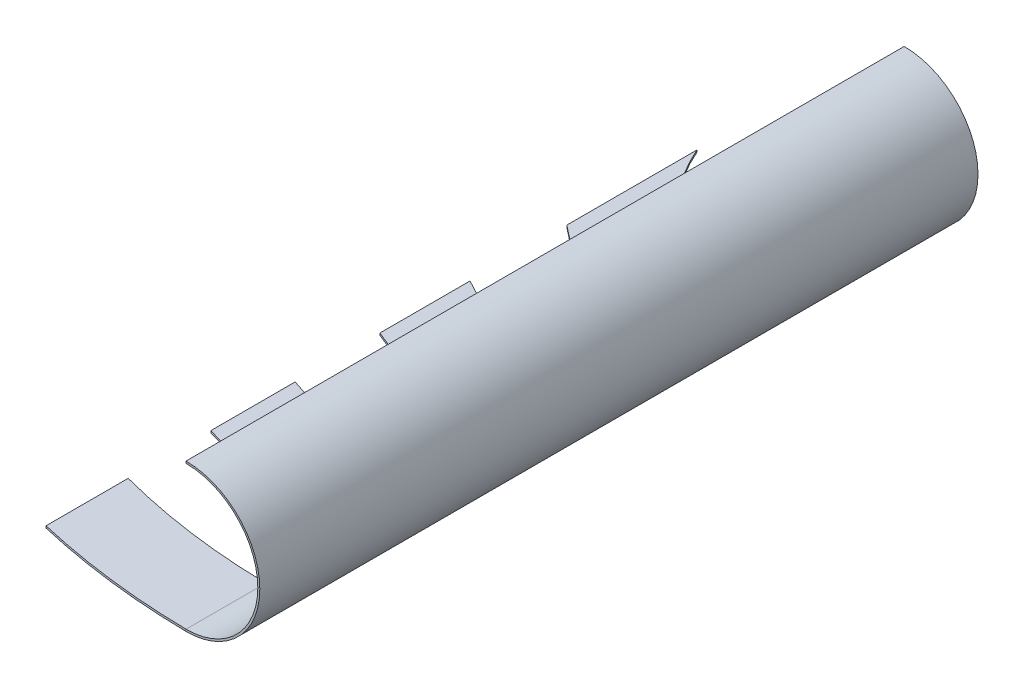
from build123d import *

# Parameters (mm, degrees)
SKETCH_1_R           = 18.5
SKETCH_1_R_2         = 18
EXTRUDE_1_DEPTH      = 180
SKETCH_15_W          = 19.647344242
SKETCH_15_H          = 48.423013506
CUT_EXTRUDE_7_DEPTH  = 208.5
SKETCH_16_W          = 20
SKETCH_16_H          = 0.5
EXTRUDE_4_DEPTH      = 40
SKETCH_17_W          = 20
SKETCH_17_H          = 1
CUT_EXTRUDE_8_DEPTH  = 40
EXTRUDE_8_DEPTH      = 0.5
CUT_EXTRUDE_10_DEPTH = 0.5


with BuildPart() as part:
    # 草图1 → 凸台-拉伸1 (new body)
    with BuildSketch(Plane.XY):
        with Locations(Location((0, 0, 0), (0, 0, 180))):
            Circle(SKETCH_1_R)
        with Locations(Location((0, 0, 0), (0, 0, 180))):
            Circle(SKETCH_1_R_2, mode=Mode.SUBTRACT)
    extrude(amount=EXTRUDE_1_DEPTH)

    # 草图15 → 切除-拉伸7 (cut, symmetric)
    with BuildSketch(Plane(origin=(0, 0, 0), x_dir=(-1, 0, 0), z_dir=(0, 0, -1))):
        with Locations((9.823672121, -2.226084919)):
            Rectangle(SKETCH_15_W, SKETCH_15_H)
    extrude(amount=CUT_EXTRUDE_7_DEPTH, both=True, mode=Mode.SUBTRACT)

    # 草图16 → 凸台-拉伸4 (add)
    with BuildSketch(Plane(origin=(0, 0, 0), x_dir=(0, 0, -1), z_dir=(1, 0, 0))):
        with Locations((-90, -18.25)):
            Rectangle(SKETCH_16_W, SKETCH_16_H)
        with Locations((-50, -18.25)):
            Rectangle(SKETCH_16_W, SKETCH_16_H)
        with Locations((-130, -18.25)):
            Rectangle(SKETCH_16_W, SKETCH_16_H)
        with Locations((-170, -18.25)):
            Rectangle(SKETCH_16_W, SKETCH_16_H)
    extrude(amount=-EXTRUDE_4_DEPTH)

    # 草图17 → 切除-拉伸8 (cut)
    with BuildSketch(Plane(origin=(0, 0, 0), x_dir=(0, 0, -1), z_dir=(1, 0, 0))):
        with Locations((-110, -18)):
            Rectangle(SKETCH_17_W, SKETCH_17_H)
        with Locations((-150, -18)):
            Rectangle(SKETCH_17_W, SKETCH_17_H)
        with Locations((-70, -18)):
            Rectangle(SKETCH_17_W, SKETCH_17_H)
    extrude(amount=CUT_EXTRUDE_8_DEPTH, mode=Mode.SUBTRACT)

    # 草图20 → 凸台-拉伸8 (add)
    with BuildSketch(Plane.XZ.offset(18.5)):
        with BuildLine():
            Line((0, 59.952777719), (0, 39.932309719))
            ThreePointArc((0, 39.932309719), (-24.004305164, 31.641271223), (-40, 11.916015014))
            Line((-40, 11.916015014), (-40, 44.556181889))
            ThreePointArc((-40, 44.556181889), (-21.280533863, 55.581277174), (0, 59.952777719))
        make_face()
        with BuildLine():
            Line((-40, 68.814162833), (-40, 91.125176599))
            ThreePointArc((-40, 91.125176599), (-20.430552708, 97.494887784), (0, 99.97057031))
            Line((0, 99.97057031), (0, 79.980767144))
            ThreePointArc((0, 79.980767144), (-20.682391226, 76.84186512), (-40, 68.814162833))
        make_face()
        with BuildLine():
            Line((0, 180), (0, 159.99002565))
            ThreePointArc((0, 159.99002565), (-20.167840481, 158.455833888), (-40, 154.483305373))
            Line((-40, 154.483305373), (-40, 175.102068383))
            ThreePointArc((-40, 175.102068383), (-20.132883898, 178.636258798), (0, 180))
        make_face()
        with BuildLine():
            Line((-40, 112.628405695), (-40, 133.686346725))
            ThreePointArc((-40, 133.686346725), (-20.218894936, 138.224000128), (0, 139.978623608))
            Line((0, 139.978623608), (0, 119.975235288))
            ThreePointArc((0, 119.975235288), (-20.297894119, 117.923712576), (-40, 112.628405695))
        make_face()
    extrude(amount=-EXTRUDE_8_DEPTH)

    # 草图21 → 切除-拉伸10 (cut)
    with BuildSketch(Plane.XZ.offset(18.5)):
        with BuildLine():
            Line((0, 79.980767144), (0, 59.952777719))
            ThreePointArc((0, 59.952777719), (-21.280533863, 55.581277174), (-40, 44.556181889))
            Line((-40, 44.556181889), (-40, 68.814162833))
            ThreePointArc((-40, 68.814162833), (-20.682391226, 76.84186512), (0, 79.980767144))
        make_face()
        with BuildLine():
            Line((-40, 91.405123559), (-40, 112.628405695))
            ThreePointArc((-40, 112.628405695), (-20.297894119, 117.923712576), (0, 119.975235288))
            Line((0, 119.975235288), (0, 100.22725283))
            ThreePointArc((0, 100.22725283), (-20.428312001, 97.758177426), (-40, 91.405123559))
        make_face()
        with BuildLine():
            Line((0, 159.99002565), (0, 140.07912782))
            ThreePointArc((0, 140.07912782), (-20.218582252, 138.325773675), (-40, 133.791368433))
            Line((-40, 133.791368433), (-40, 154.483305373))
            ThreePointArc((-40, 154.483305373), (-20.167840481, 158.455833888), (0, 159.99002565))
        make_face()
        with BuildLine():
            Line((-40, 175.084831136), (-40, 180))
            Line((-40, 180), (-40, 184.582306451))
            Line((-40, 184.582306451), (-35.32938599, 184.045292069))
            Line((-35.32938599, 184.045292069), (0, 179.983216215))
            ThreePointArc((0, 179.983216215), (-20.132908432, 178.619348164), (-40, 175.084831136))
        make_face()
    extrude(amount=-CUT_EXTRUDE_10_DEPTH, mode=Mode.SUBTRACT)


solid = part.part
